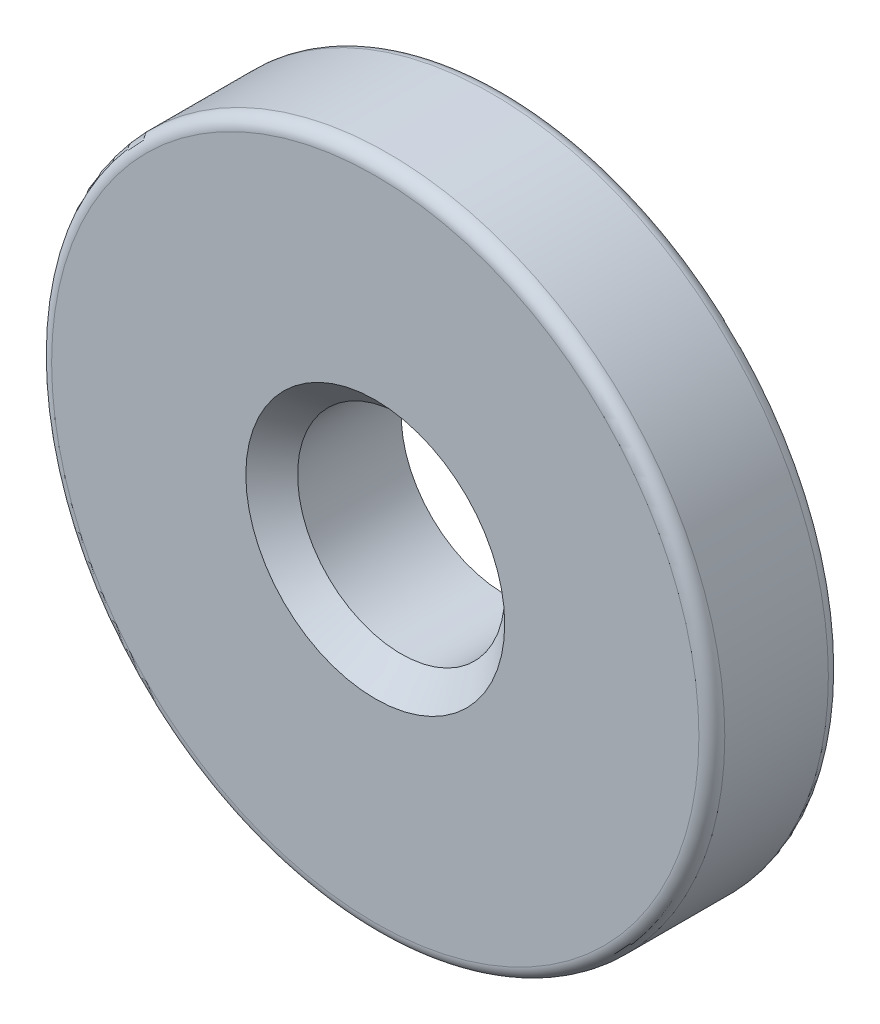
from build123d import *

# Parameters (mm, degrees)
SKETCH1_R           = 13
SKETCH1_R_2         = 4
BOSS_EXTRUDE1_DEPTH = 5
CHAMFER1_SIZE       = 1
FILLET1_R           = 0.5


with BuildPart() as part:
    # Sketch1 → Boss-Extrude1 (new body)
    with BuildSketch(Plane(origin=(0, 0, 0), x_dir=(0, 1, 0), z_dir=(0, 0, 1))):
        with Locations(Location((0, 0, 0), (0, 0, 270))):
            Circle(SKETCH1_R)
        with Locations(Location((0, 0, 0), (0, 0, 270))):
            Circle(SKETCH1_R_2, mode=Mode.SUBTRACT)
    extrude(amount=BOSS_EXTRUDE1_DEPTH)

    # Chamfer1
    chamfer1_edges = [part.edges().sort_by_distance(p)[0] for p in [
        (-4, 0, 5),
    ]]
    chamfer(chamfer1_edges, length=CHAMFER1_SIZE)

    # Fillet1
    fillet1_edges = [part.edges().sort_by_distance(p)[0] for p in [
        (-13, 0, 0),
        (-13, 0, 5),
    ]]
    fillet(fillet1_edges, radius=FILLET1_R)


solid = part.part
